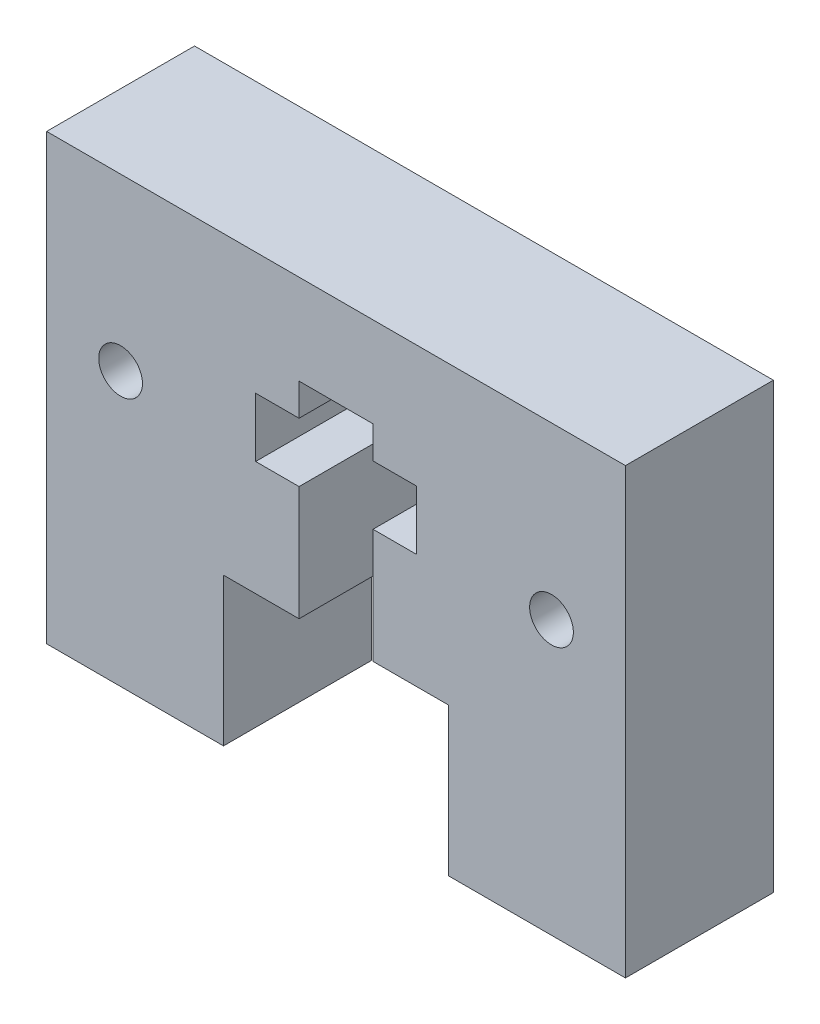
from build123d import *

# Parameters (mm, degrees)
SKETCH2_R           = 0.8636
BOSS_EXTRUDE1_DEPTH = 5.842
SKETCH4_W           = 22.86
SKETCH4_H           = 3.81
BOSS_EXTRUDE2_DEPTH = 5.842
CUT_EXTRUDE1_DEPTH  = 45.657083246


with BuildPart() as part:
    # Sketch2 → Boss-Extrude1 (new body)
    with BuildSketch(Plane.XY):
        Polygon((-42.70375, -5.842), (-35.71875, -5.842), (-35.71875, 0), (-26.82875, 0), (-26.82875, -5.842), (-19.84375, -5.842), (-19.84375, 7.874), (-42.70375, 7.874), align=None)
        with Locations((-39.78275, 4.953)):
            Circle(SKETCH2_R, mode=Mode.SUBTRACT)
        with Locations(Location((-22.76475, 4.953, 0), (0, 0, 180))):
            Circle(SKETCH2_R, mode=Mode.SUBTRACT)
    extrude(amount=BOSS_EXTRUDE1_DEPTH)

    # Sketch4 → Boss-Extrude2 (add)
    with BuildSketch(Plane.XY.offset(5.842)):
        with Locations((-31.27375, 9.779)):
            Rectangle(SKETCH4_W, SKETCH4_H)
    extrude(amount=-BOSS_EXTRUDE2_DEPTH)

    # Sketch3 → Cut-Extrude1 (cut, through all)
    with BuildSketch(Plane.XY.offset(5.842)):
        Polygon((-32.73425, 0), (-32.73425, 4.5212), (-34.44875, 4.5212), (-34.44875, 6.858), (-32.73425, 6.858), (-32.73425, 8.128), (-29.81325, 8.128), (-29.81325, 6.858), (-28.09875, 6.858), (-28.09875, 4.5212), (-29.81325, 4.5212), (-29.81325, 0), align=None)
    extrude(amount=-CUT_EXTRUDE1_DEPTH, mode=Mode.SUBTRACT)


solid = part.part
